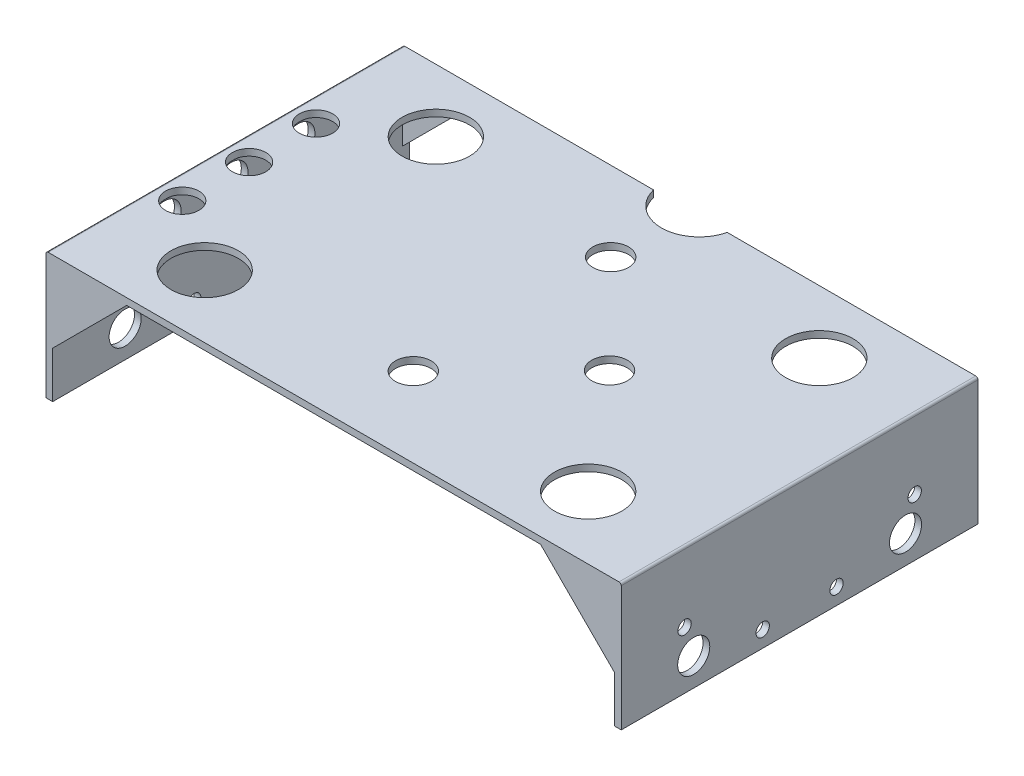
from build123d import *

# Parameters (mm, degrees)
SALIENTE_EXTRUIR1_DEPTH = 80
CROQUIS3_R              = 1.5
CROQUIS3_R_2            = 3.6
CORTAR_EXTRUIR2_DEPTH   = 155.44497402
CROQUIS4_R              = 3.75
CORTAR_EXTRUIR3_DEPTH   = 80
CROQUIS5_R              = 7.565
CROQUIS5_R_2            = 8.5
CROQUIS5_R_3            = 4
CROQUIS5_R_4            = 3.75
CORTAR_EXTRUIR4_DEPTH   = 80
SALIENTE_EXTRUIR2_DEPTH = 1.5
SALIENTE_EXTRUIR4_DEPTH = 1.5


with BuildPart() as part:
    # Croquis1 → Saliente-Extruir1 (new body)
    with BuildSketch(Plane.XY):
        with BuildLine():
            Line((0, 0), (0, 28))
            ThreePointArc((0, 28), (0.146446609, 28.353553391), (0.5, 28.5))
            Line((0.5, 28.5), (128.5, 28.5))
            ThreePointArc((128.5, 28.5), (128.853553391, 28.353553391), (129, 28))
            Line((129, 28), (129, 0))
            Line((129, 0), (127.5, 0))
            Line((127.5, 0), (127.5, 26.5))
            ThreePointArc((127.5, 26.5), (127.353553391, 26.853553391), (127, 27))
            Line((127, 27), (2, 27))
            ThreePointArc((2, 27), (1.646446609, 26.853553391), (1.5, 26.5))
            Line((1.5, 26.5), (1.5, 0))
            Line((1.5, 0), (0, 0))
        make_face()
    extrude(amount=SALIENTE_EXTRUIR1_DEPTH)

    # Croquis3 → Cortar-Extruir2 (cut, through all)
    with BuildSketch(Plane(origin=(0, 0, 0), x_dir=(0, 0, -1), z_dir=(1, 0, 0))):
        with Locations(Location((-48.28, 3.65, 0), (0, 0, 270))):
            Circle(CROQUIS3_R)
        with Locations(Location((-65.8, 12.85, 0), (0, 0, 270))):
            Circle(CROQUIS3_R)
        with Locations(Location((-63.75, 6.26, 0), (0, 0, 270))):
            Circle(CROQUIS3_R_2)
        with Locations(Location((-31.72, 3.65, 0), (0, 0, 180))):
            Circle(CROQUIS3_R)
        with Locations(Location((-16.25, 6.26, 0), (0, 0, 180))):
            Circle(CROQUIS3_R_2)
        with Locations(Location((-14.2, 12.85, 0), (0, 0, 180))):
            Circle(CROQUIS3_R)
    extrude(amount=CORTAR_EXTRUIR2_DEPTH, mode=Mode.SUBTRACT)

    # Croquis4 → Cortar-Extruir3 (cut)
    with BuildSketch(Plane(origin=(0, 0, 0), x_dir=(0, 0, -1), z_dir=(1, 0, 0))):
        with Locations(Location((-39.95, 22.7, 0), (0, 0, 270))):
            Circle(CROQUIS4_R)
        with Locations(Location((-24.95, 22.7, 0), (0, 0, 270))):
            Circle(CROQUIS4_R)
        with Locations(Location((-54.95, 22.7, 0), (0, 0, 270))):
            Circle(CROQUIS4_R)
    extrude(amount=CORTAR_EXTRUIR3_DEPTH, mode=Mode.SUBTRACT)

    # Croquis5 → Cortar-Extruir4 (cut)
    with BuildSketch(Plane(origin=(0, 0, 0), x_dir=(1, 0, 0), z_dir=(0, 1, 0))):
        with Locations((21.5, -65.92)):
            Circle(CROQUIS5_R)
        with Locations((64.5, 2)):
            Circle(CROQUIS5_R_2)
        with Locations((86.38, -40)):
            Circle(CROQUIS5_R_3)
        with Locations((64.5, -17.87)):
            Circle(CROQUIS5_R_3)
        with Locations((64.5, -62.13)):
            Circle(CROQUIS5_R_3)
        with Locations((107.5, -65.92)):
            Circle(CROQUIS5_R)
        with Locations((21.5, -14.08)):
            Circle(CROQUIS5_R)
        with Locations((107.5, -14.08)):
            Circle(CROQUIS5_R)
        with Locations(Location((5.5, -24.95, 0), (0, 0, 158.960530219))):
            Circle(CROQUIS5_R_4)
        with Locations(Location((5.5, -39.95, 0), (0, 0, 158.960530219))):
            Circle(CROQUIS5_R_4)
        with Locations(Location((5.5, -54.95, 0), (0, 0, 158.960530219))):
            Circle(CROQUIS5_R_4)
    extrude(amount=CORTAR_EXTRUIR4_DEPTH, mode=Mode.SUBTRACT)

    # Croquis6 → Saliente-Extruir2 (add)
    with BuildSketch(Plane.XY):
        Polygon((18.104253919, 27), (1.5, 10.395746081), (1.5, 27), align=None)
        Polygon((127.5, 27), (127.5, 10.395746081), (110.895746081, 27), align=None)
    extrude(amount=SALIENTE_EXTRUIR2_DEPTH)

    # Croquis7 → Saliente-Extruir4 (add)
    with BuildSketch(Plane.XY.offset(80)):
        Polygon((1.5, 27), (18.104253919, 27), (1.5, 10.395746081), align=None)
        Polygon((127.5, 27), (127.5, 10.395746081), (110.895746081, 27), align=None)
    extrude(amount=-SALIENTE_EXTRUIR4_DEPTH)


solid = part.part
